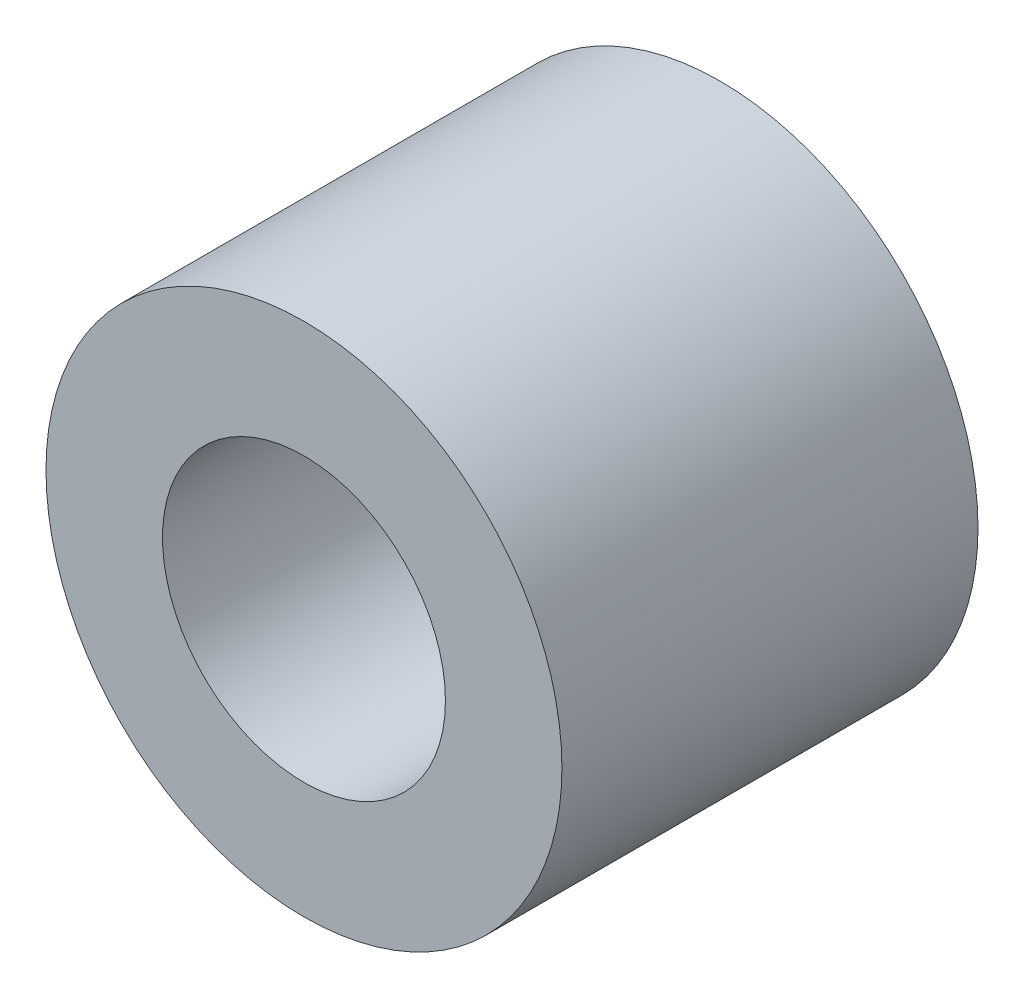
from build123d import *

# Parameters (mm, degrees)
SKETCH1_R           = 3.1
SKETCH1_R_2         = 1.7
BOSS_EXTRUDE1_DEPTH = 5


with BuildPart() as part:
    # Sketch1 → Boss-Extrude1 (new body)
    with BuildSketch(Plane.XY):
        Circle(SKETCH1_R)
        Circle(SKETCH1_R_2, mode=Mode.SUBTRACT)
    extrude(amount=BOSS_EXTRUDE1_DEPTH)


solid = part.part
